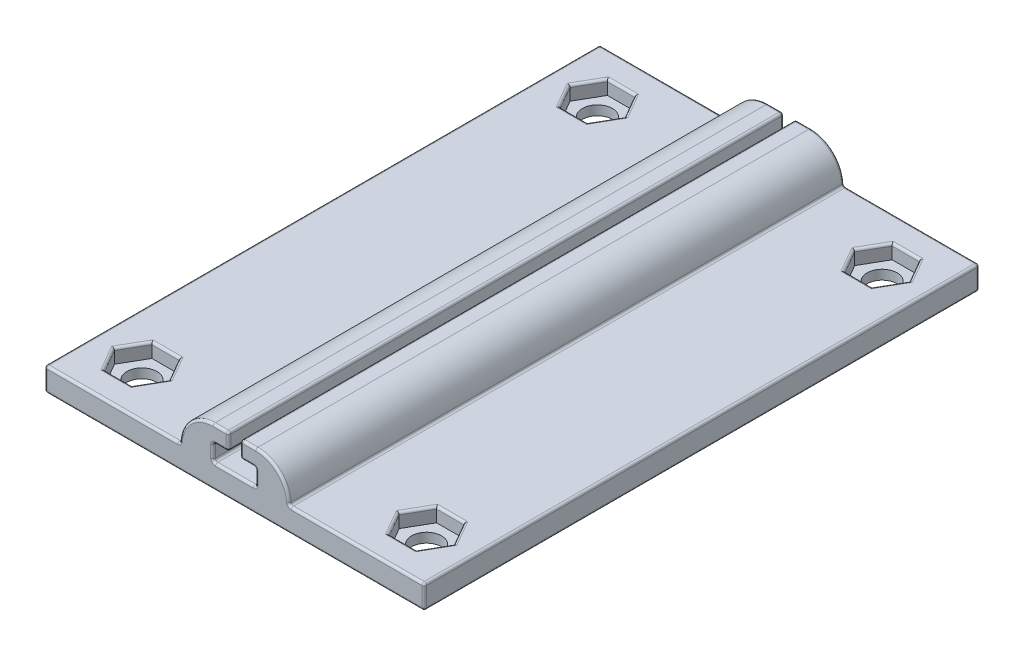
from build123d import *

# Parameters (mm, degrees)
BOSS_EXTRUDE1_DEPTH      = 58.5
BOSS_EXTRUDE1_DEPTH_BACK = 58.5
SKETCH2_R                = 3.15
CUT_EXTRUDE1_DEPTH       = 58.5
FILLET1_R                = 0.5
CUT_EXTRUDE2_DEPTH       = 3
LPATTERN1_COUNT          = 2
LPATTERN1_PITCH          = 60
FILLET2_R                = 0.5


with BuildPart() as part:
    # Sketch1 → Boss-Extrude1 (new, two sides: drawn at the far end of the back side and taken through both)
    with BuildSketch(Plane.XY.offset(-BOSS_EXTRUDE1_DEPTH_BACK)):
        with BuildLine():
            Line((-40, -2.5), (40, -2.5))
            Line((40, -2.5), (40, 2.5))
            Line((40, 2.5), (11.5, 2.5))
            ThreePointArc((11.5, 2.5), (9.449747468, 7.449747468), (4.5, 9.5))
            Line((4.5, 9.5), (1.25, 9.5))
            Line((1.25, 9.5), (1.25, 6))
            Line((1.25, 6), (4.5, 6))
            Line((4.5, 6), (4.5, 2.5))
            Line((4.5, 2.5), (-4.5, 2.5))
            Line((-4.5, 2.5), (-4.5, 6))
            Line((-4.5, 6), (-1.25, 6))
            Line((-1.25, 6), (-1.25, 9.5))
            Line((-1.25, 9.5), (-4.5, 9.5))
            ThreePointArc((-4.5, 9.5), (-9.449747468, 7.449747468), (-11.5, 2.5))
            Line((-11.5, 2.5), (-40, 2.5))
            Line((-40, 2.5), (-40, -2.5))
        make_face()
    extrude(amount=BOSS_EXTRUDE1_DEPTH + BOSS_EXTRUDE1_DEPTH_BACK)

    # Sketch2 → Cut-Extrude1 (cut)
    with BuildSketch(Plane.XZ.offset(2.5)):
        with Locations((-30, 48)):
            Circle(SKETCH2_R)
        with Locations((30, 48)):
            Circle(SKETCH2_R)
        with Locations((30, -48)):
            Circle(SKETCH2_R)
        with Locations((-30, -48)):
            Circle(SKETCH2_R)
    extrude(amount=-CUT_EXTRUDE1_DEPTH, mode=Mode.SUBTRACT)

    # Fillet1
    fillet1_edges = [part.edges().sort_by_distance(p)[0] for p in [
        (40, -2.5, 0),
        (-40, -2.5, 0),
        (-4.5, 6, 0),
        (-1.25, 6, 0),
        (-1.25, 9.5, 0),
        (1.25, 9.5, 0),
        (1.25, 6, 0),
        (4.5, 6, 0),
        (4.5, 2.5, 0),
        (-4.5, 2.5, 0),
        (-2.875, 6, -58.5),
        (-1.25, 7.75, -58.5),
        (-2.875, 9.5, -58.5),
        (-9.449747468, 7.449747468, -58.5),
        (-40, 0, -58.5),
        (0, -2.5, -58.5),
        (40, 0, -58.5),
        (9.449747468, 7.449747468, -58.5),
        (2.875, 9.5, -58.5),
        (1.25, 7.75, -58.5),
        (2.875, 6, -58.5),
        (4.5, 4.25, -58.5),
        (0, 2.5, -58.5),
        (-4.5, 4.25, -58.5),
        (0, 2.5, 58.5),
        (4.5, 4.25, 58.5),
        (2.875, 6, 58.5),
        (1.25, 7.75, 58.5),
        (2.875, 9.5, 58.5),
        (9.449747468, 7.449747468, 58.5),
        (40, 0, 58.5),
        (0, -2.5, 58.5),
        (-40, 0, 58.5),
        (-9.449747468, 7.449747468, 58.5),
        (-2.875, 9.5, 58.5),
        (-1.25, 7.75, 58.5),
        (-2.875, 6, 58.5),
        (-4.5, 4.25, 58.5),
        (-25.75, 2.5, -58.5),
        (-11.5, 2.5, 0),
        (-25.75, 2.5, 58.5),
        (-40, 2.5, 0),
        (-33.15, 2.5, -48),
        (-33.15, 2.5, 48),
        (25.75, 2.5, -58.5),
        (40, 2.5, 0),
        (25.75, 2.5, 58.5),
        (11.5, 2.5, 0),
        (26.85, 2.5, 48),
        (26.85, 2.5, -48),
    ]]
    fillet(fillet1_edges, radius=FILLET1_R)

    # Sketch3 → Cut-Extrude2 (cut)
    with BuildSketch(Plane(origin=(0, 2.5, 0), x_dir=(1, 0, 0), z_dir=(0, 1, 0))):
        Polygon((-24.226497308, 48), (-27.113248654, 53), (-32.886751346, 53), (-35.773502692, 48), (-32.886751346, 43), (-27.113248654, 43), align=None)
        Polygon((-24.226497308, -48), (-27.113248654, -43), (-32.886751346, -43), (-35.773502692, -48), (-32.886751346, -53), (-27.113248654, -53), align=None)
    cut_extrude2 = extrude(amount=-CUT_EXTRUDE2_DEPTH, mode=Mode.SUBTRACT)

    # LPattern1: Cut-Extrude2 ×2
    with Locations(*[(i * LPATTERN1_PITCH, 0, 0) for i in range(1, LPATTERN1_COUNT)]):
        add(cut_extrude2, mode=Mode.SUBTRACT)

    # Fillet2
    fillet2_edges = [part.edges().sort_by_distance(p)[0] for p in [
        (30, 2.5, 43),
        (25.669872981, 2.5, 45.5),
        (25.669872981, 2.5, 50.5),
        (30, 2.5, 53),
        (34.330127019, 2.5, 50.5),
        (34.330127019, 2.5, 45.5),
        (30, 2.5, -53),
        (25.669872981, 2.5, -50.5),
        (25.669872981, 2.5, -45.5),
        (30, 2.5, -43),
        (34.330127019, 2.5, -45.5),
        (34.330127019, 2.5, -50.5),
        (-30, 2.5, 43),
        (-34.330127019, 2.5, 45.5),
        (-34.330127019, 2.5, 50.5),
        (-30, 2.5, 53),
        (-25.669872981, 2.5, 50.5),
        (-25.669872981, 2.5, 45.5),
        (-30, 2.5, -53),
        (-34.330127019, 2.5, -50.5),
        (-34.330127019, 2.5, -45.5),
        (-30, 2.5, -43),
        (-25.669872981, 2.5, -45.5),
        (-25.669872981, 2.5, -50.5),
    ]]
    fillet(fillet2_edges, radius=FILLET2_R)


solid = part.part
